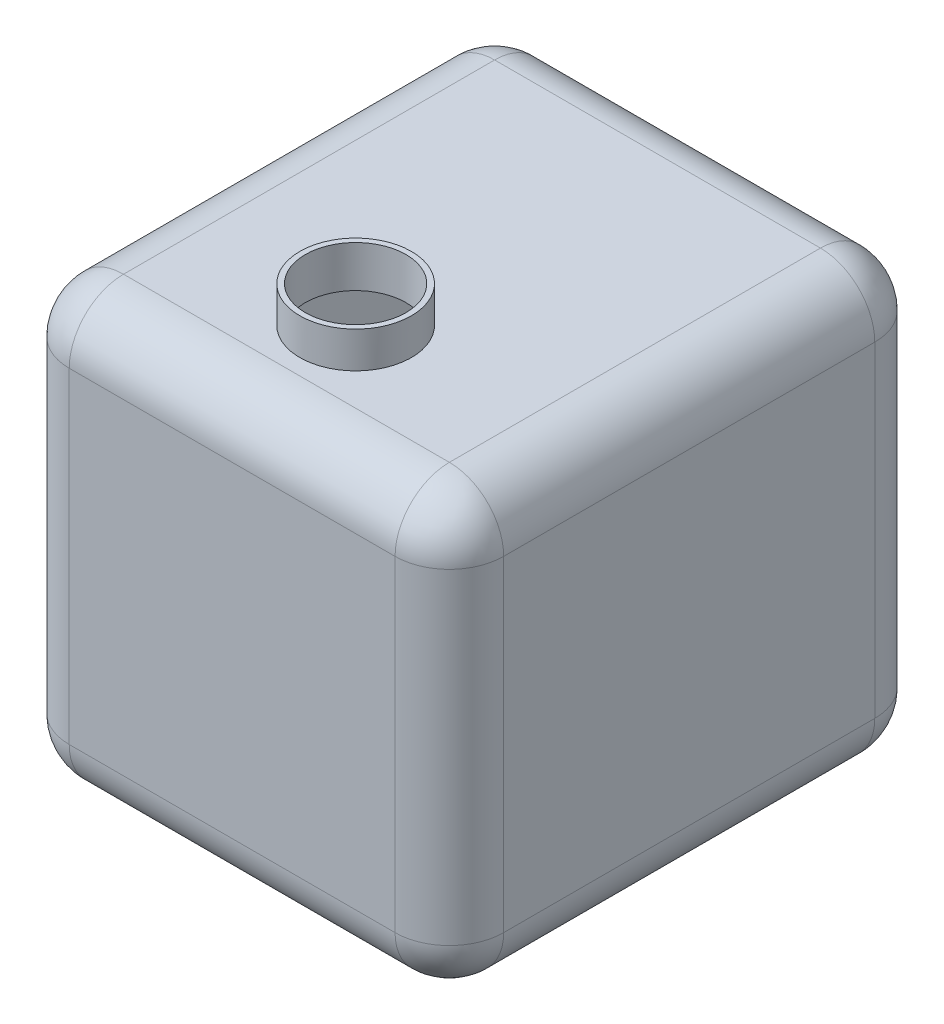
from build123d import *

# Parameters (mm, degrees)
CROQUIS1_W              = 240
CROQUIS1_H              = 265
SALIENTE_EXTRUIR1_DEPTH = 240
REDONDEO1_R             = 30
REDONDEO2_R             = 30
CROQUIS2_R              = 30.811504022
SALIENTE_EXTRUIR2_DEPTH = 20
VACIADO1_T              = -3


with BuildPart() as part:
    # Croquis1 → Saliente-Extruir1 (new body)
    with BuildSketch(Plane.XZ):
        with Locations((71.623347888, 113.329596413)):
            Rectangle(CROQUIS1_W, CROQUIS1_H)
    extrude(amount=-SALIENTE_EXTRUIR1_DEPTH)

    # Redondeo1
    redondeo1_edges = [part.edges().sort_by_distance(p)[0] for p in [
        (-48.376652112, 120, 245.829596413),
        (191.623347888, 120, 245.829596413),
        (191.623347888, 120, -19.170403587),
        (-48.376652112, 120, -19.170403587),
    ]]
    fillet(redondeo1_edges, radius=REDONDEO1_R)

    # Redondeo2
    redondeo2_edges = [part.edges().sort_by_distance(p)[0] for p in [
        (71.623347888, 0, -19.170403587),
        (71.623347888, 240, -19.170403587),
        (-48.376652112, 0, 113.329596413),
        (191.623347888, 0, 113.329596413),
        (71.623347888, 0, 245.829596413),
        (-39.589855548, 0, 237.042799848),
        (-39.589855548, 0, -10.383607023),
        (182.836551323, 0, 237.042799848),
        (182.836551323, 0, -10.383607023),
        (191.623347888, 240, 113.329596413),
        (-48.376652112, 240, 113.329596413),
        (71.623347888, 240, 245.829596413),
        (-39.589855548, 240, 237.042799848),
        (-39.589855548, 240, -10.383607023),
        (182.836551323, 240, 237.042799848),
        (182.836551323, 240, -10.383607023),
    ]]
    fillet(redondeo2_edges, radius=REDONDEO2_R)

    # Croquis2 → Saliente-Extruir2 (add)
    with BuildSketch(Plane(origin=(0, 240, 0), x_dir=(1, 0, 0), z_dir=(0, 1, 0))):
        with Locations(Location((70.222158981, -176.211697137, 0), (0, 0, 90))):
            Circle(CROQUIS2_R)
    extrude(amount=SALIENTE_EXTRUIR2_DEPTH)

    # Vaciado1
    vaciado1_openings = [part.faces().sort_by_distance(p)[0] for p in [
        (70.222158981, 260, 176.211697137),
    ]]
    offset(amount=VACIADO1_T, openings=vaciado1_openings, kind=Kind.INTERSECTION)


solid = part.part
